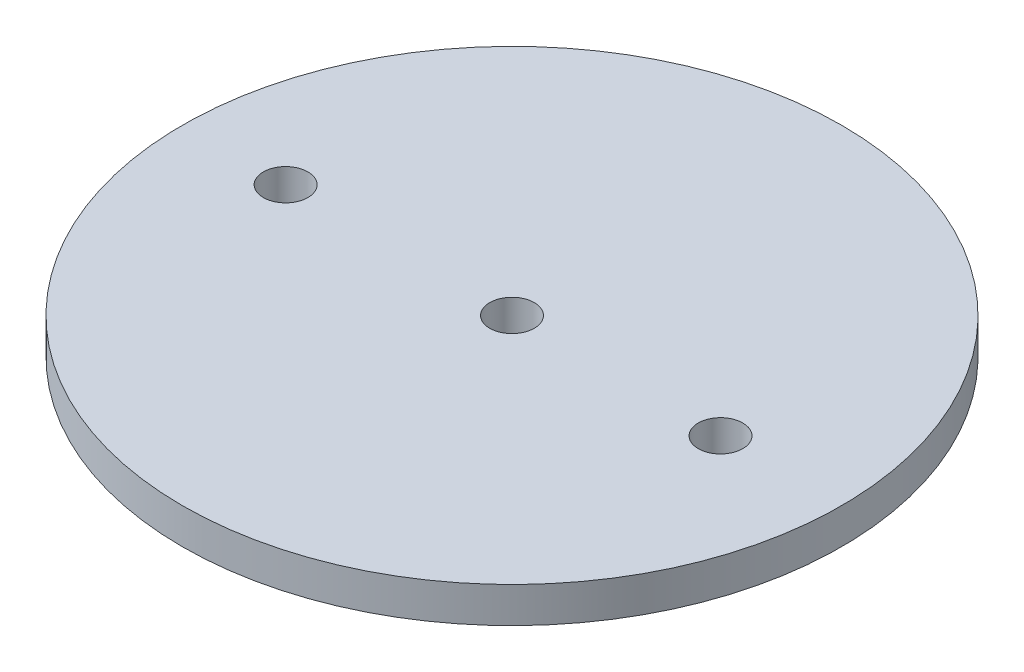
from build123d import *

# Parameters (mm, degrees)
SKETCH1_R           = 46.99
BOSS_EXTRUDE1_DEPTH = 5.08
SKETCH2_R           = 3.175
CUT_EXTRUDE1_DEPTH  = 67.647780158


with BuildPart() as part:
    # Sketch1 → Boss-Extrude1 (new body)
    with BuildSketch(Plane(origin=(0, 0, 0), x_dir=(1, 0, 0), z_dir=(0, 1, 0))):
        with Locations(Location((0, 0, 0), (0, 0, 270))):
            Circle(SKETCH1_R)
    extrude(amount=BOSS_EXTRUDE1_DEPTH)

    # Sketch2 → Cut-Extrude1 (cut, through all)
    with BuildSketch(Plane(origin=(0, 5.08, 0), x_dir=(1, 0, 0), z_dir=(0, 1, 0))):
        with Locations(Location((-32.277971852, 0, 0), (0, 0, 270))):
            Circle(SKETCH2_R)
        with Locations(Location((0, 0, 0), (0, 0, 270))):
            Circle(SKETCH2_R)
        with Locations(Location((29.730021339, 0, 0), (0, 0, 270))):
            Circle(SKETCH2_R)
    extrude(amount=-CUT_EXTRUDE1_DEPTH, mode=Mode.SUBTRACT)


solid = part.part
